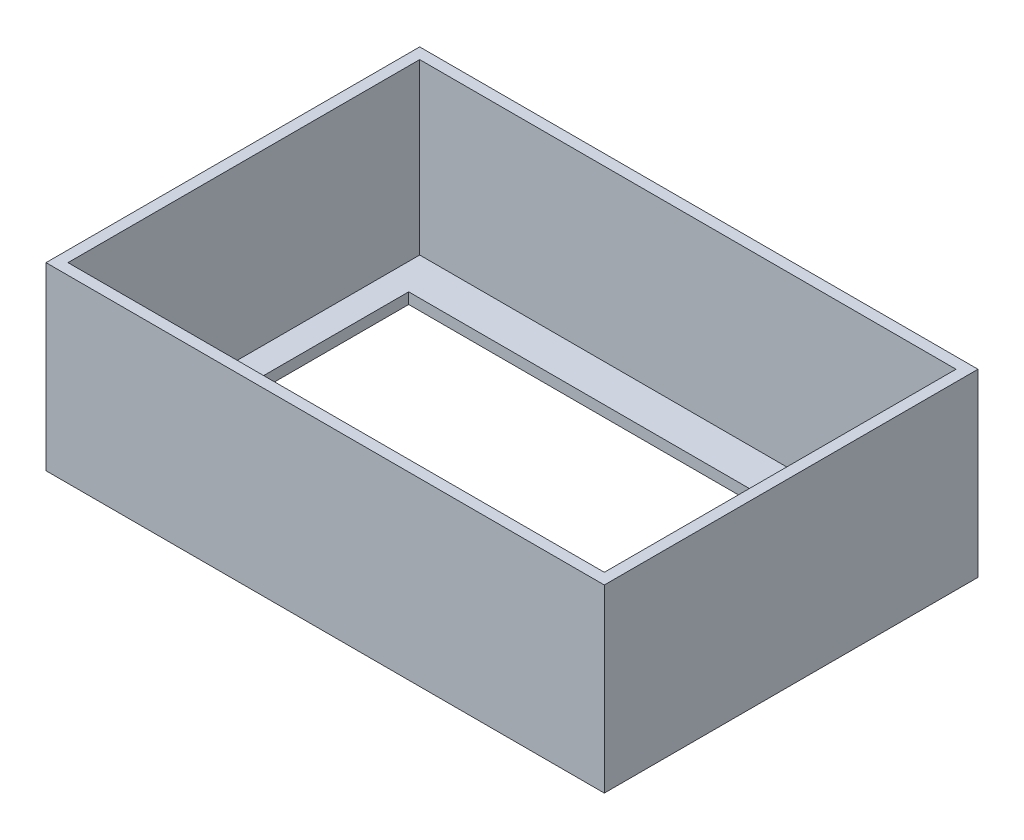
from build123d import *

# Parameters (mm, degrees)
SKETCH1_W           = 127
SKETCH1_H           = 85
BOSS_EXTRUDE1_DEPTH = 2.5
SKETCH2_W           = 127
SKETCH2_H           = 85
SKETCH2_W_2         = 122
SKETCH2_H_2         = 80
BOSS_EXTRUDE2_DEPTH = 38.5
SKETCH3_W           = 110
SKETCH3_H           = 68.5
CUT_EXTRUDE1_DEPTH  = 2.5


with BuildPart() as part:
    # Sketch1 → Boss-Extrude1 (new body)
    with BuildSketch(Plane(origin=(0, 0, 0), x_dir=(1, 0, 0), z_dir=(0, 1, 0))):
        with Locations((63.5, 42.5)):
            Rectangle(SKETCH1_W, SKETCH1_H)
    extrude(amount=BOSS_EXTRUDE1_DEPTH)

    # Sketch2 → Boss-Extrude2 (add)
    with BuildSketch(Plane(origin=(0, 2.5, 0), x_dir=(1, 0, 0), z_dir=(0, 1, 0))):
        with Locations((63.5, 42.5)):
            Rectangle(SKETCH2_W, SKETCH2_H)
        with Locations((63.5, 42.5)):
            Rectangle(SKETCH2_W_2, SKETCH2_H_2, mode=Mode.SUBTRACT)
    extrude(amount=BOSS_EXTRUDE2_DEPTH)

    # Sketch3 → Cut-Extrude1 (cut)
    with BuildSketch(Plane(origin=(0, 0, 0), x_dir=(-1, 0, 0), z_dir=(0, -1, 0))):
        with Locations((-63.5, 39.75)):
            Rectangle(SKETCH3_W, SKETCH3_H)
    extrude(amount=-CUT_EXTRUDE1_DEPTH, mode=Mode.SUBTRACT)


solid = part.part
